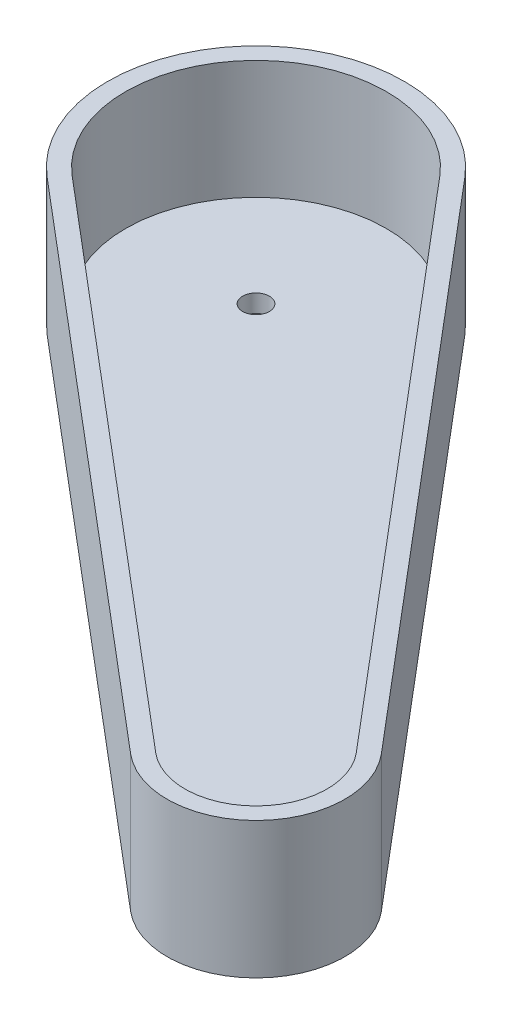
from build123d import *

# Parameters (mm, degrees)
EXTRUDE_2_DEPTH     = 3
EXTRUDE_3_DEPTH     = 20
SKETCH_5_R          = 2.25
SKETCH_5_R_2        = 2.5
CUT_EXTRUDE_1_DEPTH = 98.430183655


with BuildPart() as part:
    # 草图2 → 凸台-拉伸2 (new body)
    with BuildSketch(Plane(origin=(0, 0, 0), x_dir=(1, 0, 0), z_dir=(0, 1, 0))):
        with BuildLine():
            Line((-58.569449541, 23.337085947), (32.740581269, -53.879999426))
            ThreePointArc((32.740581269, -53.879999426), (53.033008589, -53.033008589), (53.879999426, -32.740581269))
            Line((53.879999426, -32.740581269), (-23.337085947, 58.569449541))
            ThreePointArc((-23.337085947, 58.569449541), (-60.104076401, 60.104076401), (-58.569449541, 23.337085947))
        make_face()
    extrude(amount=EXTRUDE_2_DEPTH)

    # 草图4 → 凸台-拉伸3 (add)
    with BuildSketch(Plane(origin=(0, 3, 0), x_dir=(1, 0, 0), z_dir=(0, 1, 0))):
        with BuildLine():
            ThreePointArc((-23.337085947, 58.569449541), (-60.104076401, 60.104076401), (-58.569449541, 23.337085947))
            Line((-58.569449541, 23.337085947), (32.740581269, -53.879999426))
            ThreePointArc((32.740581269, -53.879999426), (53.033008589, -53.033008589), (53.879999426, -32.740581269))
            Line((53.879999426, -32.740581269), (-23.337085947, 58.569449541))
        make_face()
        with BuildLine():
            ThreePointArc((-56.632284421, 25.627804458), (-57.982756057, 57.982756057), (-25.627804458, 56.632284421))
            Line((-25.627804458, 56.632284421), (51.589280915, -34.67774639))
            ThreePointArc((51.589280915, -34.67774639), (50.911688245, -50.911688245), (34.67774639, -51.589280915))
            Line((34.67774639, -51.589280915), (-56.632284421, 25.627804458))
        make_face(mode=Mode.SUBTRACT)
    extrude(amount=EXTRUDE_3_DEPTH)

    # 草图5 → 切除-拉伸1 (cut, through all)
    with BuildSketch(Plane(origin=(0, 3, 0), x_dir=(1, 0, 0), z_dir=(0, 1, 0))):
        with Locations(Location((-42.426406871, 42.426406871, 0), (0, 0, 270))):
            Circle(SKETCH_5_R)
        with Locations(Location((42.426406871, -42.426406871, 0), (0, 0, 270))):
            Circle(SKETCH_5_R_2)
    extrude(amount=-CUT_EXTRUDE_1_DEPTH, mode=Mode.SUBTRACT)


solid = part.part
